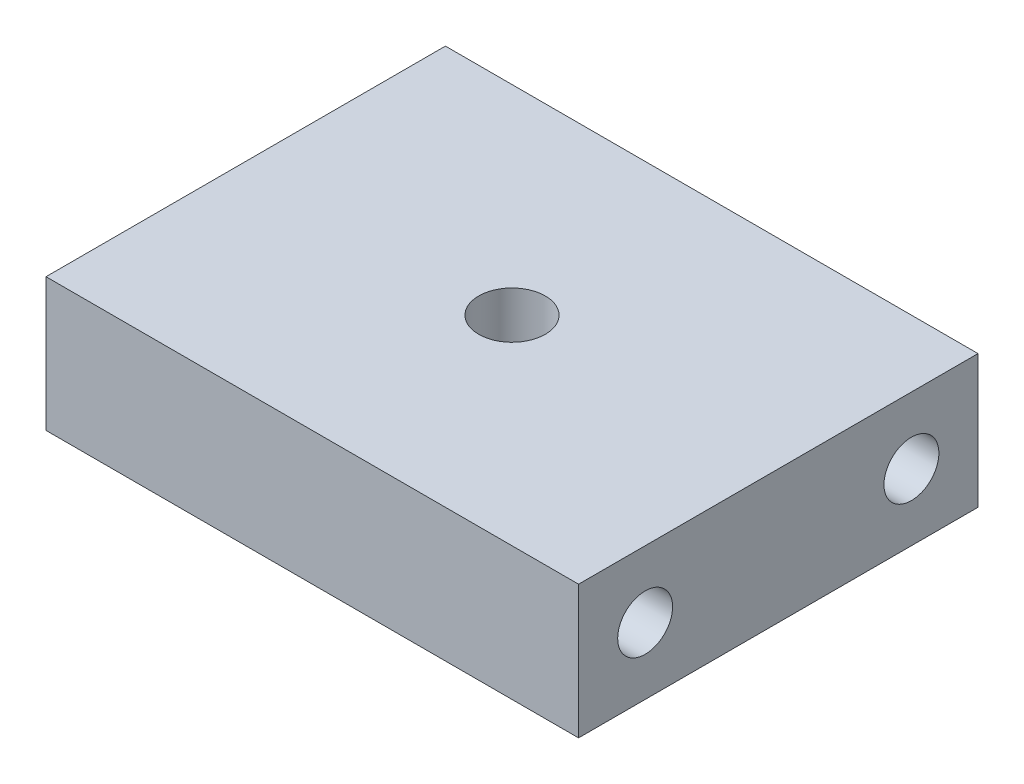
from build123d import *

# Parameters (mm, degrees)
ESQUISSE1_W             = 32
ESQUISSE1_H             = 24
BOSS_EXTRU_1_DEPTH      = 8
ESQUISSE2_R             = 2
ENL_V_MAT_EXTRU_1_DEPTH = 8
ENL_V_MAT_EXTRU_2_REACH = 37.543
ESQUISSE3_R             = 1.65
ENL_V_MAT_EXTRU_3_REACH = 37.543
ESQUISSE4_R             = 1.65


with BuildPart() as part:
    # Esquisse1 → Boss.-Extru.1 (new body)
    with BuildSketch(Plane(origin=(0, 0, 0), x_dir=(1, 0, 0), z_dir=(0, 1, 0))):
        with Locations((3.126436782, 1.24137931)):
            Rectangle(ESQUISSE1_W, ESQUISSE1_H)
    extrude(amount=BOSS_EXTRU_1_DEPTH)

    # Esquisse2 → Enlèv. mat.-Extru.1 (cut)
    with BuildSketch(Plane(origin=(0, 8, 0), x_dir=(1, 0, 0), z_dir=(0, 1, 0))):
        with Locations(Location((3.126436782, 1.24137931, 0), (0, 0, 270))):
            Circle(ESQUISSE2_R)
    extrude(amount=-ENL_V_MAT_EXTRU_1_DEPTH, mode=Mode.SUBTRACT)

    # Esquisse3 → Enlèv. mat.-Extru.2 (cut, up to next)
    with BuildSketch(Plane.ZY.offset(12.873563218), mode=Mode.PRIVATE) as enl_v_mat_extru_2_sk1:
        with Locations((-9.24137931, 4)):
            Circle(ESQUISSE3_R)
    enl_v_mat_extru_2_tool1 = extrude(enl_v_mat_extru_2_sk1.sketch, amount=-ENL_V_MAT_EXTRU_2_REACH, mode=Mode.PRIVATE) & part.part
    add(enl_v_mat_extru_2_tool1.solids().sort_by_distance((-12.873563, 4, -9.241379))[0], mode=Mode.SUBTRACT)

    # Esquisse4 → Enlèv. mat.-Extru.3 (cut, up to next)
    with BuildSketch(Plane.ZY.offset(12.873563218), mode=Mode.PRIVATE) as enl_v_mat_extru_3_sk1:
        with Locations((6.75862069, 4)):
            Circle(ESQUISSE4_R)
    enl_v_mat_extru_3_tool1 = extrude(enl_v_mat_extru_3_sk1.sketch, amount=-ENL_V_MAT_EXTRU_3_REACH, mode=Mode.PRIVATE) & part.part
    add(enl_v_mat_extru_3_tool1.solids().sort_by_distance((-12.873563, 4, 6.758621))[0], mode=Mode.SUBTRACT)


solid = part.part
